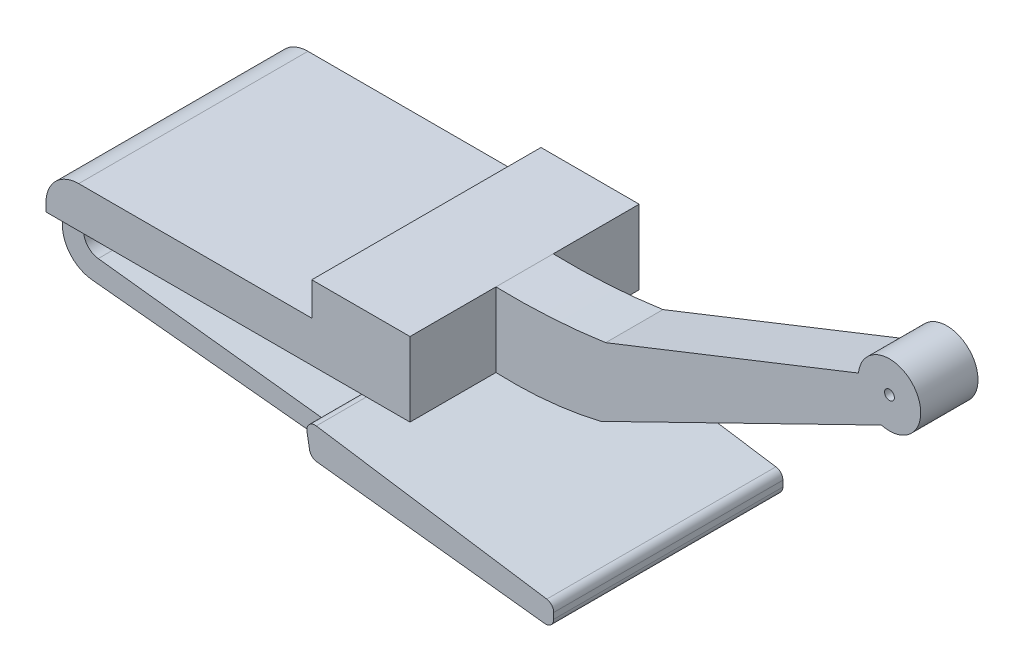
from build123d import *

# Parameters (mm, degrees)
BOSS_EXTRUDE1_DEPTH = 7
BOSS_EXTRUDE2_DEPTH = 6
BOSS_EXTRUDE3_DEPTH = 7
SKETCH4_R           = 0.3
BOSS_EXTRUDE4_DEPTH = 1.75


with BuildPart() as part:
    # Sketch1 → Boss-Extrude1 (new, symmetric)
    with BuildSketch(Plane.XY):
        with BuildLine():
            Line((9.176470588, 3.852941176), (9.176470588, 8.382352941))
            Line((9.176470588, 8.382352941), (3.176470588, 8.382352941))
            Line((3.176470588, 8.382352941), (3.176470588, 6.352941176))
            Line((3.176470588, 6.352941176), (-11.058823529, 6.352941176))
            ThreePointArc((-11.058823529, 6.352941176), (-12.473037092, 5.767154739), (-13.058823529, 4.352941176))
            Line((-13.058823529, 4.352941176), (-13.058823529, 3.852941176))
            Line((-13.058823529, 3.852941176), (9.176470588, 3.852941176))
        make_face()
    extrude(amount=BOSS_EXTRUDE1_DEPTH, both=True)

    # Sketch2 → Boss-Extrude2 (add, symmetric)
    with BuildSketch(Plane.XY):
        with BuildLine():
            Line((-13.058823529, 3.852941176), (-13.058823529, 2.660454677))
            ThreePointArc((-13.058823529, 2.660454677), (-12.542636873, 1.319448352), (-11.260525567, 0.670651599))
            Line((-11.260525567, 0.670651599), (3.072810241, -0.782287673))
            Line((3.072810241, -0.782287673), (3.072810241, 0.357643739))
            Line((3.072810241, 0.357643739), (-10.868321542, 1.982265031))
            ThreePointArc((-10.868321542, 1.982265031), (-11.499481128, 2.310618881), (-11.752570466, 2.975543285))
            Line((-11.752570466, 2.975543285), (-11.752570466, 3.852941176))
            Line((-11.752570466, 3.852941176), (-13.058823529, 3.852941176))
        make_face()
    extrude(amount=BOSS_EXTRUDE2_DEPTH, both=True)

    # Sketch3 → Boss-Extrude3 (add, symmetric)
    with BuildSketch(Plane.XY):
        with BuildLine():
            Line((2.883131421, 0.205607724), (3.042051607, -0.684345316))
            ThreePointArc((3.042051607, -0.684345316), (3.191971306, -0.960915025), (3.477393899, -1.0932051))
            Line((3.477393899, -1.0932051), (17.397932492, -2.686911621))
            ThreePointArc((17.397932492, -2.686911621), (17.787643477, -2.563275633), (17.954803987, -2.190156518))
            Line((17.954803987, -2.190156518), (17.954803987, -1.828059238))
            ThreePointArc((17.954803987, -1.828059238), (17.833783341, -1.50190797), (17.529305388, -1.333640851))
            Line((17.529305388, -1.333640851), (3.449846609, 0.78792143))
            ThreePointArc((3.449846609, 0.78792143), (3.017025208, 0.642224676), (2.883131421, 0.205607724))
        make_face()
    extrude(amount=BOSS_EXTRUDE3_DEPTH, both=True)

    # Sketch4 → Boss-Extrude4 (add, symmetric)
    with BuildSketch(Plane.XY):
        with BuildLine():
            Line((15.880495921, 8.784024701), (31.318309496, 14.894554405))
            ThreePointArc((31.318309496, 14.894554405), (34.7916946, 15.766688386), (32.722657859, 12.843657643))
            Line((32.722657859, 12.843657643), (15.583027287, 4.472426378))
            add(Edge.make_bspline(
                [(9.176470588, 3.852941176), (12.411471434, 3.711455216), (15.583027287, 4.472426378)],
                knots=[0, 0, 0, 1, 1, 1], degree=2))
            Line((9.176470588, 3.852941176), (9.176470588, 8.382352941))
            add(Edge.make_bspline(
                [(9.176470588, 8.382352941), (12.540784879, 8.295907329), (15.880495921, 8.784024701)],
                knots=[0, 0, 0, 1, 1, 1], degree=2))
        make_face()
        with Locations((33.216362624, 14.687982269)):
            Circle(SKETCH4_R, mode=Mode.SUBTRACT)
    extrude(amount=BOSS_EXTRUDE4_DEPTH, both=True)


solid = part.part
